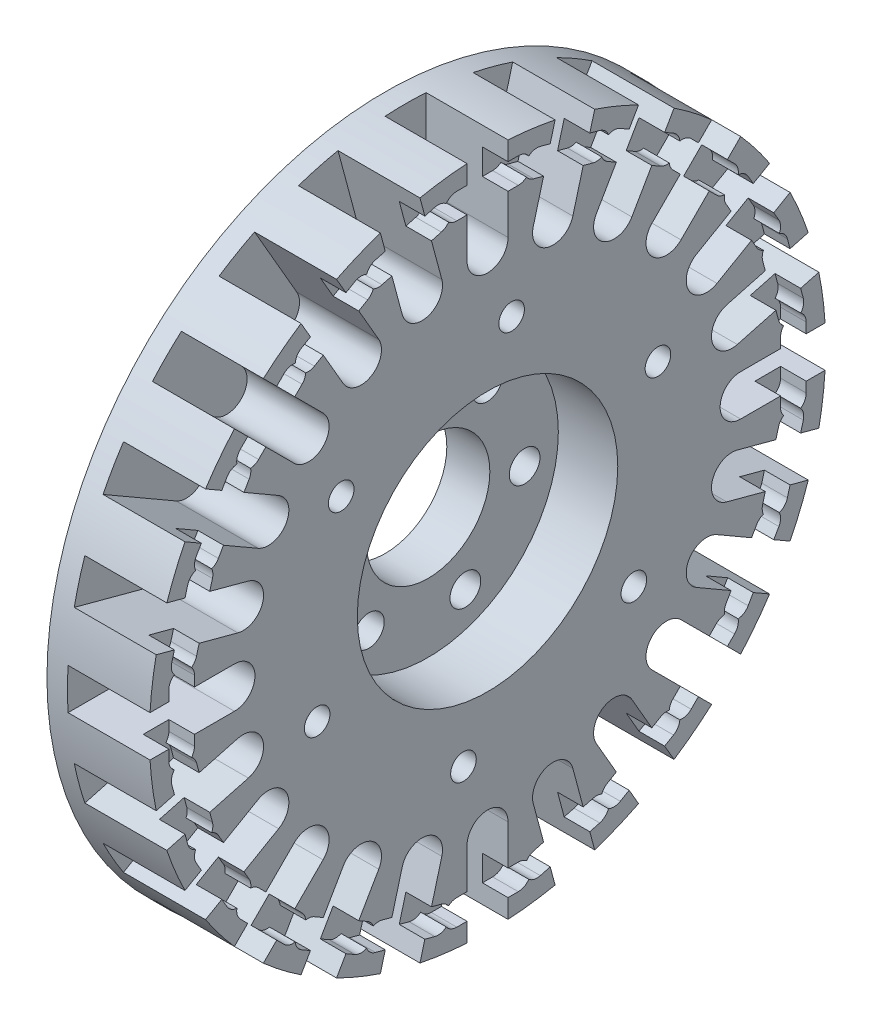
from build123d import *

# Parameters (mm, degrees)
SKETCH1_R                    = 33
SKETCH1_R_2                  = 6.025
BOSS_EXTRUDE1_DEPTH          = 10
CUT_EXTRUDE1_DEPTH           = 8
CUT_EXTRUDE2_DEPTH           = 2.5
CIRPATTERN1_COUNT            = 24
TAP_DRILL_FOR_M3X0_5_TAP1_D  = 2.5
CIRPATTERN2_COUNT            = 6
SKETCH7_R                    = 12.71
CUT_EXTRUDE3_DEPTH           = 5.8
CUT_EXTRUDE4_REACH           = 49.728
SKETCH11_R                   = 1.5
CHAMFER1_SIZE                = 1.5
CIRPATTERN3_COUNT            = 6
CHAMFER1_OF_CIRPATTERN3_SIZE = 1.5


with BuildPart() as part:
    # Sketch1 → Boss-Extrude1 (new body)
    with BuildSketch(Plane(origin=(0, 0, 0), x_dir=(0, 0, -1), z_dir=(1, 0, 0))):
        Circle(SKETCH1_R)
        Circle(SKETCH1_R_2, mode=Mode.SUBTRACT)
    extrude(amount=BOSS_EXTRUDE1_DEPTH)

    # Sketch2 → Cut-Extrude1 (cut)
    with BuildSketch(Plane(origin=(10, 0, 0), x_dir=(0, 0, -1), z_dir=(1, 0, 0))):
        with BuildLine():
            Line((-2, 33), (2, 33))
            Line((2, 33), (2, 24.7))
            ThreePointArc((2, 24.7), (0, 22.7), (-2, 24.7))
            Line((-2, 24.7), (-2, 33))
        make_face()
    cut_extrude1 = extrude(amount=-CUT_EXTRUDE1_DEPTH, mode=Mode.SUBTRACT)

    # Sketch3 → Cut-Extrude2 (cut)
    with BuildSketch(Plane(origin=(10, 0, 0), x_dir=(0, 0, -1), z_dir=(1, 0, 0))):
        with BuildLine():
            Line((-3, 31.1), (3, 31.1))
            ThreePointArc((3, 31.1), (4.25, 29.85), (3, 28.6))
            Line((3, 28.6), (-3, 28.6))
            ThreePointArc((-3, 28.6), (-4.25, 29.85), (-3, 31.1))
        make_face()
    cut_extrude2 = extrude(amount=-CUT_EXTRUDE2_DEPTH, mode=Mode.SUBTRACT)

    # CirPattern1: Cut-Extrude1, Cut-Extrude2 ×24 about axis
    cirpattern1_axis = Axis((0, 0, 0), (1, 0, 0))
    add([cut_extrude1.rotate(cirpattern1_axis, i * 360 / CIRPATTERN1_COUNT) for i in range(1, CIRPATTERN1_COUNT)], mode=Mode.SUBTRACT)
    add([cut_extrude2.rotate(cirpattern1_axis, i * 360 / CIRPATTERN1_COUNT) for i in range(1, CIRPATTERN1_COUNT)], mode=Mode.SUBTRACT)

    # Tap Drill for M3x0.5 Tap1 (through all)
    with Locations(Plane(origin=(10, 0, 0), x_dir=(0, 0, -1), z_dir=(1, 0, 0))):
        with Locations((2.34947146, 17.846007505)):
            tap_drill_for_m3x0_5_tap1 = Hole(TAP_DRILL_FOR_M3X0_5_TAP1_D / 2)

    # CirPattern2: Tap Drill for M3x0.5 Tap1 ×6 about axis
    cirpattern2_axis = Axis((0, 0, 0), (1, 0, 0))
    for i in range(1, CIRPATTERN2_COUNT):
        add(tap_drill_for_m3x0_5_tap1.rotate(cirpattern2_axis, i * 360 / CIRPATTERN2_COUNT), mode=Mode.SUBTRACT)

    # Sketch7 → Cut-Extrude3 (cut)
    with BuildSketch(Plane.ZY.offset(-10)):
        with Locations(Location((0, 0, 0), (0, 0, 180))):
            Circle(SKETCH7_R)
    extrude(amount=CUT_EXTRUDE3_DEPTH, mode=Mode.SUBTRACT)

    # Sketch11 → Cut-Extrude4 (cut, up to next)
    with BuildSketch(Plane(origin=(10, 0, 0), x_dir=(0, 0, -1), z_dir=(1, 0, 0)), mode=Mode.PRIVATE) as cut_extrude4_sk1:
        with Locations((-3.635492607, 8.776855559)):
            Circle(SKETCH11_R)
    cut_extrude4_tool1 = extrude(cut_extrude4_sk1.sketch, amount=-CUT_EXTRUDE4_REACH, mode=Mode.PRIVATE) & part.part
    cut_extrude4 = cut_extrude4_tool1.solids().sort_by_distance((10, 8.776856, 3.635493))[0]
    add(cut_extrude4, mode=Mode.SUBTRACT)

    # Chamfer1
    chamfer1_edges = [part.edges().sort_by_distance(p)[0] for p in [
        (0, 8.776855559, 5.135492607),
    ]]
    chamfer(chamfer1_edges, length=CHAMFER1_SIZE)

    # CirPattern3: Cut-Extrude4 ×6 about axis
    cirpattern3_axis = Axis((0, 0, 0), (1, 0, 0))
    for i in range(1, CIRPATTERN3_COUNT):
        add(cut_extrude4.rotate(cirpattern3_axis, i * 360 / CIRPATTERN3_COUNT), mode=Mode.SUBTRACT)

    # Chamfer1 of CirPattern3
    chamfer1_of_cirpattern3_edges = [part.edges().sort_by_distance(p)[0] for p in [
        (0, -0.05903928, 10.168726183),
        (0, -8.835894838, 5.033233576),
        (0, -8.776855559, -5.135492607),
        (0, 0.05903928, -10.168726183),
        (0, 8.835894838, -5.033233576),
    ]]
    chamfer(chamfer1_of_cirpattern3_edges, length=CHAMFER1_OF_CIRPATTERN3_SIZE)


solid = part.part
